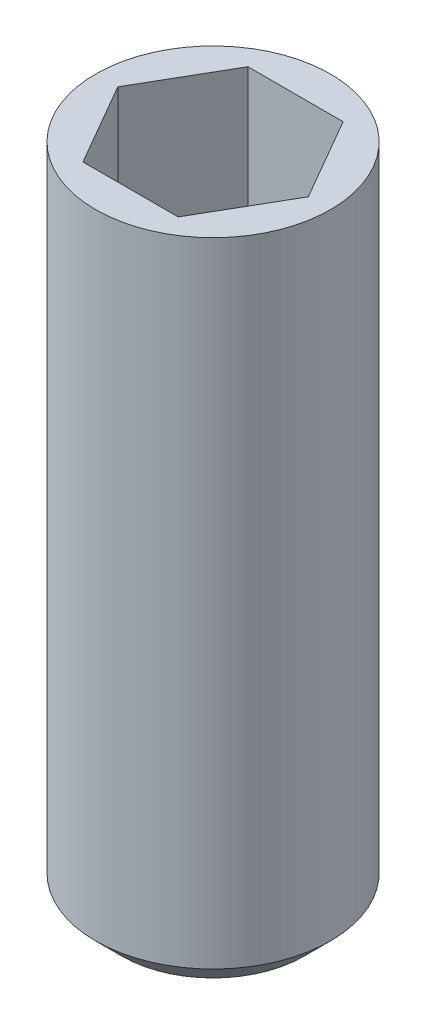
from build123d import *

# Parameters (mm, degrees)
SKETCH1_R           = 1.1303
BOSS_EXTRUDE1_DEPTH = 6.35
CHAMFER1_SIZE       = 0.254
CUT_EXTRUDE1_DEPTH  = 1.27


with BuildPart() as part:
    # Sketch1 → Boss-Extrude1 (new body)
    with BuildSketch(Plane(origin=(0, 0, 0), x_dir=(1, 0, 0), z_dir=(0, 1, 0))):
        with Locations(Location((0, 0, 0), (0, 0, 270))):
            Circle(SKETCH1_R)
    extrude(amount=-BOSS_EXTRUDE1_DEPTH)

    # Chamfer1
    chamfer1_edges = [part.edges().sort_by_distance(p)[0] for p in [
        (0, -6.35, -1.1303),
    ]]
    chamfer(chamfer1_edges, length=CHAMFER1_SIZE)

    # Sketch2 → Cut-Extrude1 (cut)
    with BuildSketch(Plane(origin=(0, 0, 0), x_dir=(1, 0, 0), z_dir=(0, 1, 0))):
        Polygon((-0.916543552, 0), (-0.458271776, -0.79375), (0.458271776, -0.79375), (0.916543552, 0), (0.458271776, 0.79375), (-0.458271776, 0.79375), align=None)
    extrude(amount=-CUT_EXTRUDE1_DEPTH, mode=Mode.SUBTRACT)


solid = part.part
